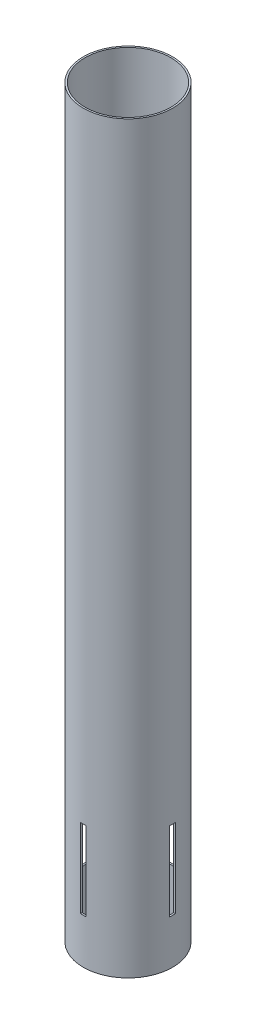
from build123d import *

# Parameters (mm, degrees)
SKETCH1_R           = 39.6
SKETCH1_R_2         = 38.1
BOSS_EXTRUDE1_DEPTH = 660
SKETCH2_W           = 5
SKETCH2_H           = 70
CUT_EXTRUDE1_DEPTH  = 663.371738528
CIRPATTERN1_COUNT   = 4


with BuildPart() as part:
    # Sketch1 → Boss-Extrude1 (new body)
    with BuildSketch(Plane(origin=(0, 0, 0), x_dir=(1, 0, 0), z_dir=(0, 1, 0))):
        with Locations(Location((0, 0, 0), (0, 0, 270))):
            Circle(SKETCH1_R)
        with Locations(Location((0, 0, 0), (0, 0, 270))):
            Circle(SKETCH1_R_2, mode=Mode.SUBTRACT)
    extrude(amount=BOSS_EXTRUDE1_DEPTH)

    # Sketch2 → Cut-Extrude1 (cut, through all)
    with BuildSketch(Plane.XY):
        with Locations((0, 75)):
            Rectangle(SKETCH2_W, SKETCH2_H)
    cut_extrude1 = extrude(amount=-CUT_EXTRUDE1_DEPTH, mode=Mode.SUBTRACT)

    # CirPattern1: Cut-Extrude1 ×4 about axis
    cirpattern1_axis = Axis((0, 0, 0), (0, 1, 0))
    for i in range(1, CIRPATTERN1_COUNT):
        add(cut_extrude1.rotate(cirpattern1_axis, i * 360 / CIRPATTERN1_COUNT), mode=Mode.SUBTRACT)


solid = part.part
